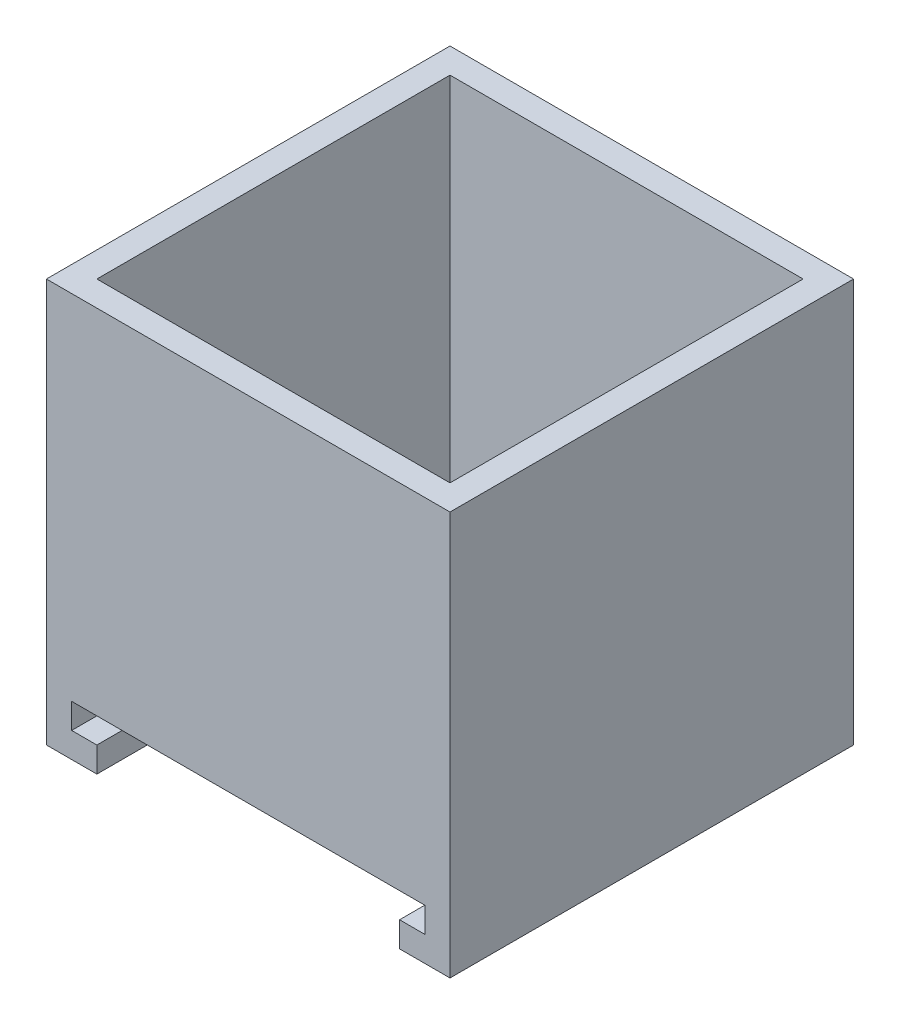
from build123d import *

# Parameters (mm, degrees)
SKETCH1_W           = 80
SKETCH1_H           = 80
BOSS_EXTRUDE1_DEPTH = 80
CUT_EXTRUDE1_DEPTH  = 114
SKETCH3_W           = 70
SKETCH3_H           = 70
CUT_EXTRUDE3_DEPTH  = 70


with BuildPart() as part:
    # Sketch1 → Boss-Extrude1 (new body)
    with BuildSketch(Plane.XY):
        with Locations((-40, 40)):
            Rectangle(SKETCH1_W, SKETCH1_H)
    extrude(amount=BOSS_EXTRUDE1_DEPTH)

    # Sketch2 → Cut-Extrude1 (cut)
    with BuildSketch(Plane.XY.offset(80)):
        Polygon((-70, 5), (-70, 0), (-10, 0), (-10, 5), (-5, 5), (-5, 10), (-75, 10), (-75, 5), align=None)
    extrude(amount=-CUT_EXTRUDE1_DEPTH, mode=Mode.SUBTRACT)

    # Sketch3 → Cut-Extrude3 (cut)
    with BuildSketch(Plane(origin=(0, 80, 0), x_dir=(1, 0, 0), z_dir=(0, 1, 0))):
        with Locations((-40, -40)):
            Rectangle(SKETCH3_W, SKETCH3_H)
    extrude(amount=-CUT_EXTRUDE3_DEPTH, mode=Mode.SUBTRACT)


solid = part.part
